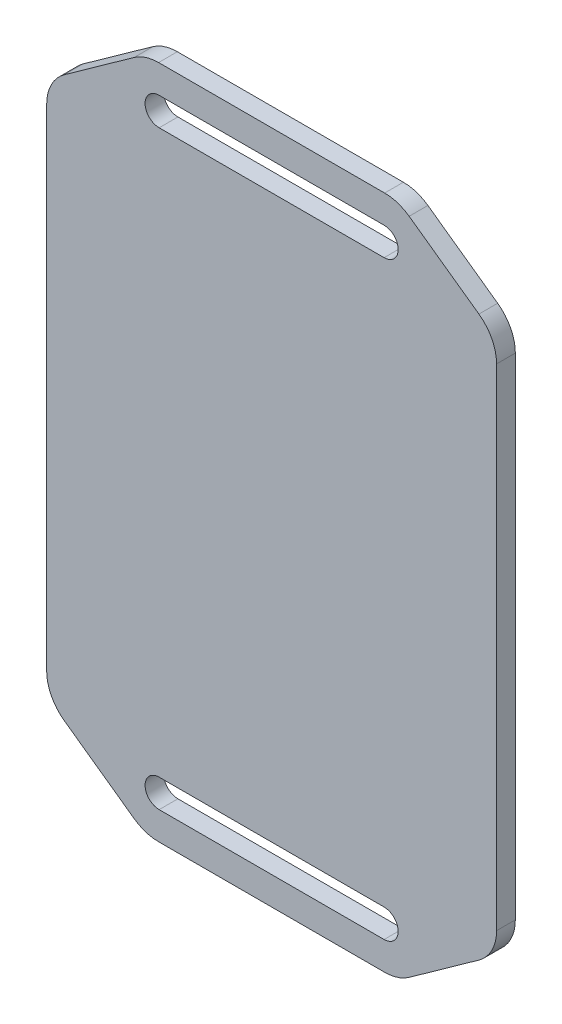
from build123d import *

# Parameters (mm, degrees)
EXTRUIR1_DEPTH = 2


with BuildPart() as part:
    # Croquis1 → Extruir1 (new body)
    with BuildSketch(Plane.XY):
        with BuildLine():
            Line((200.095995896, 161.842834793), (200.095995896, 214.210663326))
            ThreePointArc((200.095995896, 214.210663326), (199.597250288, 216.26978044), (198.211567768, 217.872463947))
            Line((198.211567768, 217.872463947), (190.769475027, 223.188244475))
            ThreePointArc((190.769475027, 223.188244475), (189.527201595, 223.811773643), (188.153903155, 224.026443855))
            Line((188.153903155, 224.026443855), (164.038088636, 224.026443855))
            ThreePointArc((164.038088636, 224.026443855), (162.664790197, 223.811773643), (161.422516764, 223.188244475))
            Line((161.422516764, 223.188244475), (153.980424024, 217.872463947))
            ThreePointArc((153.980424024, 217.872463947), (152.594741504, 216.26978044), (152.095995896, 214.210663326))
            Line((152.095995896, 214.210663326), (152.095995896, 161.842834793))
            ThreePointArc((152.095995896, 161.842834793), (152.594741504, 159.783717679), (153.980424024, 158.181034173))
            Line((153.980424024, 158.181034173), (161.422516764, 152.865253644))
            ThreePointArc((161.422516764, 152.865253644), (162.664790197, 152.241724476), (164.038088636, 152.027054264))
            Line((164.038088636, 152.027054264), (188.153903155, 152.027054264))
            ThreePointArc((188.153903155, 152.027054264), (189.527201595, 152.241724476), (190.769475027, 152.865253644))
            Line((190.769475027, 152.865253644), (198.211567768, 158.181034173))
            ThreePointArc((198.211567768, 158.181034173), (199.597250288, 159.783717679), (200.095995896, 161.842834793))
        make_face()
        with BuildLine():
            Line((164.095995896, 158.027054265), (188.095995896, 158.027054265))
            ThreePointArc((188.095995896, 158.027054265), (189.595995896, 156.527054264), (188.095995896, 155.027054265))
            Line((188.095995896, 155.027054265), (164.095995896, 155.027054265))
            ThreePointArc((164.095995896, 155.027054265), (162.595995896, 156.527054264), (164.095995896, 158.027054265))
        make_face(mode=Mode.SUBTRACT)
        with BuildLine():
            Line((164.095995896, 221.027054265), (188.095995896, 221.027054265))
            ThreePointArc((188.095995896, 221.027054265), (189.595995896, 219.527054264), (188.095995896, 218.027054265))
            Line((188.095995896, 218.027054265), (164.095995896, 218.027054265))
            ThreePointArc((164.095995896, 218.027054265), (162.595995896, 219.527054264), (164.095995896, 221.027054265))
        make_face(mode=Mode.SUBTRACT)
    extrude(amount=EXTRUIR1_DEPTH)


solid = part.part
